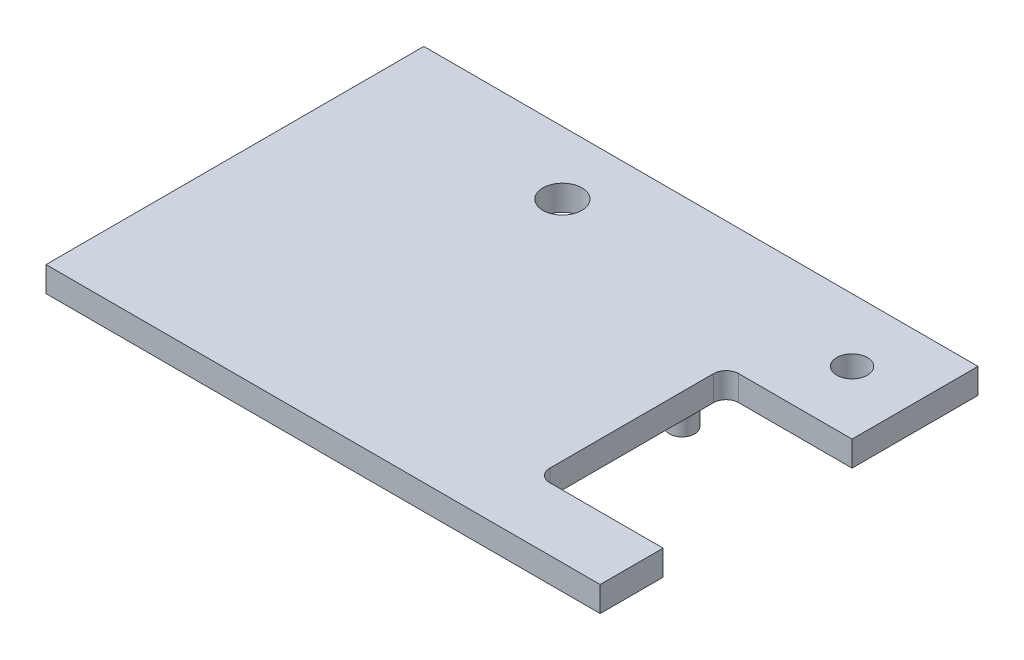
from build123d import *

# Parameters (mm, degrees)
SKETCH1_W           = 44
SKETCH1_H           = 30
SKETCH1_R           = 1.2192
SKETCH1_R_2         = 1.55
BOSS_EXTRUDE1_DEPTH = 2
SKETCH2_R           = 1
BOSS_EXTRUDE2_DEPTH = 1.5
FILLET1_R           = 1
SKETCH4_R           = 1
BOSS_EXTRUDE3_DEPTH = 2.4
SKETCH5_W           = 10
SKETCH5_H           = 15
CUT_EXTRUDE1_DEPTH  = 27.988145546
FILLET2_R           = 1


with BuildPart() as part:
    # Sketch1 → Boss-Extrude1 (new body)
    with BuildSketch(Plane(origin=(0, 0, 0), x_dir=(1, 0, 0), z_dir=(0, 1, 0))):
        Rectangle(SKETCH1_W, SKETCH1_H)
        with Locations(Location((17, 10, 0), (0, 0, 270))):
            Circle(SKETCH1_R, mode=Mode.SUBTRACT)
        with Locations(Location((-6, 10, 0), (0, 0, 270))):
            Circle(SKETCH1_R_2, mode=Mode.SUBTRACT)
    extrude(amount=BOSS_EXTRUDE1_DEPTH)

    # Sketch2 → Boss-Extrude2 (add)
    with BuildSketch(Plane(origin=(0, 0, 0), x_dir=(-1, 0, 0), z_dir=(0, -1, 0))):
        with Locations(Location((19, 12, 0), (0, 0, 90))):
            Circle(SKETCH2_R)
        with Locations(Location((-10, -12.5, 0), (0, 0, 90))):
            Circle(SKETCH2_R)
    extrude(amount=BOSS_EXTRUDE2_DEPTH)

    # Fillet1
    fillet1_edges = [part.edges().sort_by_distance(p)[0] for p in [
        (-19, -1.5, -11),
        (10, -1.5, 13.5),
    ]]
    fillet(fillet1_edges, radius=FILLET1_R)

    # Sketch4 → Boss-Extrude3 (add)
    with BuildSketch(Plane.XZ):
        with Locations(Location((10, 8.5, 0), (0, 0, 270))):
            Circle(SKETCH4_R)
        with Locations(Location((-18.5, -3.5, 0), (0, 0, 270))):
            Circle(SKETCH4_R)
        with Locations(Location((10, -3.5, 0), (0, 0, 270))):
            Circle(SKETCH4_R)
    extrude(amount=BOSS_EXTRUDE3_DEPTH)

    # Sketch5 → Cut-Extrude1 (cut, through all)
    with BuildSketch(Plane(origin=(0, 2, 0), x_dir=(1, 0, 0), z_dir=(0, 1, 0))):
        with Locations((17, -2.5)):
            Rectangle(SKETCH5_W, SKETCH5_H)
    extrude(amount=-CUT_EXTRUDE1_DEPTH, mode=Mode.SUBTRACT)

    # Fillet2
    fillet2_edges = [part.edges().sort_by_distance(p)[0] for p in [
        (12, 1, 10),
        (12, 1, -5),
    ]]
    fillet(fillet2_edges, radius=FILLET2_R)


solid = part.part
